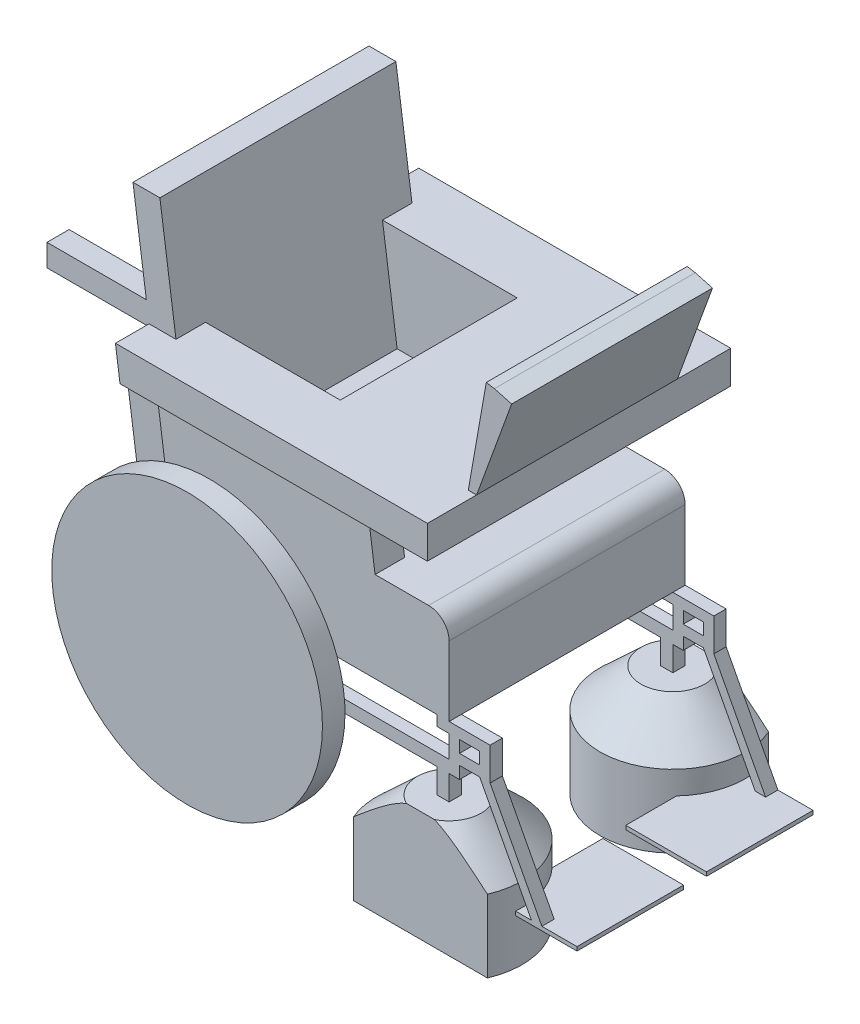
from build123d import *

# Parameters (mm, degrees)
SKETCH1_R                 = 330.2
BOSS_EXTRUDE1_DEPTH       = 55
SKETCH2_R                 = 330.2
BOSS_EXTRUDE2_DEPTH       = 55
BOSS_EXTRUDE3_DEPTH       = 10
BOSS_EXTRUDE6_DEPTH       = 575.8
BOSS_EXTRUDE33_DEPTH      = 370
BOSS_EXTRUDE33_DEPTH_BACK = 370
SKETCH25_W                = 366.7
SKETCH25_H                = 80
SKETCH5_W                 = 450
SKETCH5_H                 = 72
BOSS_EXTRUDE7_DEPTH       = 367.981167426
SKETCH8_W                 = 49.2
SKETCH8_H                 = 29.2
BOSS_EXTRUDE13_DEPTH      = 30
SKETCH19_R                = 177.8
BOSS_EXTRUDE22_DEPTH      = 270.2
CHAMFER1_SIZE             = 100
CHAMFER1_SIZE2            = 93.251508614
BOSS_EXTRUDE27_DEPTH      = 30
BOSS_EXTRUDE20_DEPTH      = 260
SKETCH23_W                = 30
SKETCH23_H                = 60
SKETCH23_W_2              = 49.2
SKETCH23_H_2              = 25.4
SKETCH23_W_3              = 25.4
BOSS_EXTRUDE28_DEPTH      = 30
SKETCH24_R                = 177.8
BOSS_EXTRUDE29_DEPTH      = 270.2
CHAMFER2_SIZE             = 100
CHAMFER2_SIZE2            = 93.251508614
BOSS_EXTRUDE30_DEPTH      = 30
BOSS_EXTRUDE31_DEPTH      = 260
SKETCH16_W                = 250
SKETCH16_H                = 53.975
BOSS_EXTRUDE18_DEPTH      = 53.975
SKETCH18_W                = 250
SKETCH18_H                = 53.975
BOSS_EXTRUDE19_DEPTH      = 53.975
BOSS_EXTRUDE32_REACH      = 1866.083
BOSS_EXTRUDE34_REACH      = 1575.824
SKETCH26_W                = 154.1
SKETCH26_H                = 80
SKETCH27_W                = 350
SKETCH27_H                = 400
BOSS_EXTRUDE35_DEPTH      = 200
BOSS_EXTRUDE36_START      = -130
BOSS_EXTRUDE36_DEPTH      = 490
FILLET3_R                 = 50
SKETCH30_W                = 2623.123535912
SKETCH30_H                = 2390.43733062
CUT_EXTRUDE1_DEPTH        = 1887.551796433
SKETCH31_W                = 2584.765961417
SKETCH31_H                = 1828.147621016
CUT_EXTRUDE2_DEPTH        = 1855.050466041


with BuildPart() as part:
    # Sketch1 → Boss-Extrude1 (new body)
    with BuildSketch(Plane.XY):
        with Locations((330.2, 330.2)):
            Circle(SKETCH1_R)
    extrude(amount=-BOSS_EXTRUDE1_DEPTH)



with BuildPart() as body_2:
    # Sketch2 → Boss-Extrude2 (new body)
    with BuildSketch(Plane.XY.offset(-685.8)):
        with Locations((330.2, 330.2)):
            Circle(SKETCH2_R)
    extrude(amount=BOSS_EXTRUDE2_DEPTH)


with BuildPart() as part_1:
    add(part.part)

    add(body_2.part)  # Boss-Extrude3 merges body 2
    # 3DSketch2 → Boss-Extrude3 (add)
    with BuildSketch(Plane(origin=(330.2, 460, -630.8), x_dir=(0.5893057409504111, 0, 0.807910108664873), z_dir=(0, -1, 0))):
        Polygon((465.194640569, 339.322245639), (0, 0), (247.508411199, -339.322245639), (712.703051768, 0), align=None)
        Polygon((-38.304873162, 52.514157063), (0, 0), (465.194640569, 339.322245639), (426.889767407, 391.836402702), align=None)
    extrude(amount=-BOSS_EXTRUDE3_DEPTH)

    # Sketch4 → Boss-Extrude6 (add)
    with BuildSketch(Plane(origin=(0, -170.8, -630.8), x_dir=(1, 0, 0), z_dir=(0, 0, 1))):
        Polygon((208.828935151, 1364.6), (330.2, 501), (265.832575532, 491.953748438), (143.190142937, 1364.6), align=None)
    extrude(amount=BOSS_EXTRUDE6_DEPTH)

    # Sketch5 → Boss-Extrude7 (add, along a direction that is not the sketch's normal)
    with BuildSketch(Plane(origin=(0, 470, 0), x_dir=(1, 0, 0), z_dir=(0, 1, 0))):
        with Locations((535.552391309, 91)):
            Rectangle(SKETCH5_W, SKETCH5_H)
        with Locations((535.552391309, 594.8)):
            Rectangle(SKETCH5_W, SKETCH5_H)
    extrude(amount=BOSS_EXTRUDE7_DEPTH, dir=(-0.13917310096006222, 0.9902680687415708, 0))

    # Sketch8 → Boss-Extrude13 (add)
    with BuildSketch(Plane(origin=(0, 0, -630.8), x_dir=(-1, 0, 0), z_dir=(0, 0, -1))):
        Polygon((-1014.4, 360.2), (-939.8, 360.2), (-939.8, 330.2), (-914.4, 330.2), (-914.4, 270.2), (-884.4, 270.2), (-884.4, 330.2), (-330.2, 330.2), (-325.983774959, 360.2), (-914.4, 360.2), (-914.4, 414.8), (-884.4, 414.8), (-884.4, 440.2), (-1014.4, 440.2), align=None)
        with Locations((-964.4, 400.2)):
            Rectangle(SKETCH8_W, SKETCH8_H, mode=Mode.SUBTRACT)
    extrude(amount=-BOSS_EXTRUDE13_DEPTH)

    # Sketch19 → Boss-Extrude22 (add)
    with BuildSketch(Plane.XZ.offset(-270.2)):
        with Locations(Location((899.4, -615.8, 0), (0, 0, 90))):
            Circle(SKETCH19_R)
    extrude(amount=BOSS_EXTRUDE22_DEPTH)

    # Chamfer1
    chamfer1_edges = [part_1.edges().sort_by_distance(p)[0] for p in [
        (899.4, 270.2, -793.6),
    ]]
    chamfer1_side = [part_1.faces().sort_by_distance(p)[0] for p in [
        (899.4, 270.2, -788.571056572),
    ]]
    chamfer(chamfer1_edges, length=CHAMFER1_SIZE, length2=CHAMFER1_SIZE2, reference=chamfer1_side[0])

    # Sketch8<7> → Boss-Extrude27 (add)
    with BuildSketch(Plane(origin=(0, 0, -630.8), x_dir=(-1, 0, 0), z_dir=(0, 0, -1))):
        Polygon((-1014.4, 360.2), (-1140.7, 120.65), (-1115.3, 120.65), (-989, 360.2), align=None)
    extrude(amount=-BOSS_EXTRUDE27_DEPTH)

    # Sketch8<4> → Boss-Extrude20 (add)
    with BuildSketch(Plane(origin=(0, 0, -630.8), x_dir=(-1, 0, 0), z_dir=(0, 0, -1))):
        Polygon((-1226.425, 111.125), (-1226.425, 120.65), (-1140.7, 120.65), (-1115.3, 120.65), (-1029.575, 120.65), (-1029.575, 111.125), align=None)
    extrude(amount=-BOSS_EXTRUDE20_DEPTH)

    # Sketch23 → Boss-Extrude28 (add)
    with BuildSketch(Plane(origin=(0, 0, -55), x_dir=(-1, 0, 0), z_dir=(0, 0, -1))):
        with BuildLine():
            Line((-330.2, 360.2), (-659.034365601, 360.2))
            ThreePointArc((-659.034365601, 360.2), (-660.058414719, 345.215533268), (-660.4, 330.2))
            Line((-660.4, 330.2), (-330.2, 330.2))
            Line((-330.2, 330.2), (-330.2, 360.2))
        make_face()
        with BuildLine():
            Line((-914.4, 360.2), (-939.8, 360.2))
            Line((-939.8, 360.2), (-939.8, 330.2))
            Line((-939.8, 330.2), (-914.4, 330.2))
            Line((-914.4, 330.2), (-884.4, 330.2))
            Line((-884.4, 330.2), (-660.4, 330.2))
            ThreePointArc((-660.4, 330.2), (-660.058414719, 345.215533268), (-659.034365601, 360.2))
            Line((-659.034365601, 360.2), (-914.4, 360.2))
        make_face()
        with Locations((-899.4, 300.2)):
            Rectangle(SKETCH23_W, SKETCH23_H)
        Polygon((-939.8, 385.6), (-939.8, 360.2), (-914.4, 360.2), (-914.4, 414.8), (-914.4, 440.2), (-939.8, 440.2), (-939.8, 414.8), align=None)
        with Locations((-964.4, 372.9)):
            Rectangle(SKETCH23_W_2, SKETCH23_H_2)
        with Locations((-964.4, 427.5)):
            Rectangle(SKETCH23_W_2, SKETCH23_H_2)
        Polygon((-1014.4, 440.2), (-1014.4, 385.6), (-989, 385.6), (-989, 414.8), (-989, 440.2), align=None)
        with Locations((-1001.7, 372.9)):
            Rectangle(SKETCH23_W_3, SKETCH23_H_2)
        Polygon((-325.983774959, 360.2), (-330.2, 360.2), (-330.2, 330.2), align=None)
        with Locations((-899.4, 427.5)):
            Rectangle(SKETCH23_W, SKETCH23_H_2)
    extrude(amount=BOSS_EXTRUDE28_DEPTH)

    # Sketch24 → Boss-Extrude29 (add)
    with BuildSketch(Plane(origin=(0, 270.2, 0), x_dir=(-1, 0, 0), z_dir=(0, -1, 0))):
        with Locations(Location((-899.4, 70, 0), (0, 0, 270))):
            Circle(SKETCH24_R)
    extrude(amount=BOSS_EXTRUDE29_DEPTH)

    # Chamfer2
    chamfer2_edges = [part_1.edges().sort_by_distance(p)[0] for p in [
        (899.4, 270.2, -247.8),
    ]]
    chamfer2_side = [part_1.faces().sort_by_distance(p)[0] for p in [
        (899.4, 270.2, -242.771056572),
    ]]
    chamfer(chamfer2_edges, length=CHAMFER2_SIZE, length2=CHAMFER2_SIZE2, reference=chamfer2_side[0])

    # Sketch23<10> → Boss-Extrude30 (add)
    with BuildSketch(Plane(origin=(0, 0, -55), x_dir=(-1, 0, 0), z_dir=(0, 0, -1))):
        Polygon((-1014.4, 360.2), (-1140.7, 120.65), (-1115.3, 120.65), (-989, 360.2), align=None)
    extrude(amount=BOSS_EXTRUDE30_DEPTH)

    # Sketch23<12> → Boss-Extrude31 (add)
    with BuildSketch(Plane(origin=(0, 0, -55), x_dir=(-1, 0, 0), z_dir=(0, 0, -1))):
        Polygon((-1226.425, 111.125), (-1226.425, 120.65), (-1140.7, 120.65), (-1115.3, 120.65), (-1029.575, 120.65), (-1029.575, 111.125), align=None)
    extrude(amount=BOSS_EXTRUDE31_DEPTH)

    # Sketch16 → Boss-Extrude18 (add)
    with BuildSketch(Plane(origin=(0, 0, -630.8), x_dir=(-1, 0, 0), z_dir=(0, 0, -1))):
        with Locations((-58.349686454, 935.0375)):
            Rectangle(SKETCH16_W, SKETCH16_H)
    extrude(amount=-BOSS_EXTRUDE18_DEPTH)

    # Sketch18 → Boss-Extrude19 (add)
    with BuildSketch(Plane(origin=(0, 0, -55), x_dir=(-1, 0, 0), z_dir=(0, 0, -1))):
        with Locations((-58.349686454, 935.0375)):
            Rectangle(SKETCH18_W, SKETCH18_H)
    extrude(amount=BOSS_EXTRUDE19_DEPTH)

    # Boss-Extrude32: up to this face of the body (flat: up to its plane)
    boss_extrude32_end = Plane(part_1.part.faces().sort_by_distance((283.205191665, 255.458003874, -55))[0])
    # Sketch8<8> → Boss-Extrude32 (add, up to the picked face)
    with BuildSketch(Plane(origin=(0, 0, -630.8), x_dir=(-1, 0, 0), z_dir=(0, 0, -1)), mode=Mode.PRIVATE) as boss_extrude32_sk1:
        Polygon((-314.740508183, 440.2), (-283.793416381, 660.4), (-914.4, 660.4), (-914.4, 440.2), align=None)
    boss_extrude32_tool1 = split(extrude(boss_extrude32_sk1.sketch, amount=-BOSS_EXTRUDE32_REACH, mode=Mode.PRIVATE), bisect_by=boss_extrude32_end, keep=Keep.BOTH, mode=Mode.PRIVATE)
    add(boss_extrude32_tool1.solids().sort_by(Axis((606.768609, 551.223181, -630.8), (0, 0, 1)))[0])



with BuildPart() as body_2_2:
    # Sketch25 → Boss-Extrude33 (new, two sides: drawn at the far end of the back side and taken through both)
    with BuildSketch(Plane.XY.offset(-342.9).offset(-BOSS_EXTRUDE33_DEPTH_BACK)):
        with Locations((760.189311143, 874.4)):
            Rectangle(SKETCH25_W, SKETCH25_H)
    extrude(amount=BOSS_EXTRUDE33_DEPTH + BOSS_EXTRUDE33_DEPTH_BACK)


with BuildPart() as part_2:
    add(part_1.part)

    add(body_2_2.part)  # Boss-Extrude34 merges body 2 2
    # Boss-Extrude34: up to this plane
    boss_extrude34_end = Plane(origin=(143.190142937, 1193.8, 837.459616456), z_dir=(0.9902680687415708, 0.13917310096006216, 0))
    # Sketch26 → Boss-Extrude34 (add, up to the surface)
    with BuildSketch(Plane.ZY.offset(-576.839311143), mode=Mode.PRIVATE) as boss_extrude34_sk1:
        with Locations((-49.95, 874.4)):
            Rectangle(SKETCH26_W, SKETCH26_H)
    boss_extrude34_tool1 = split(extrude(boss_extrude34_sk1.sketch, amount=BOSS_EXTRUDE34_REACH, mode=Mode.PRIVATE), bisect_by=boss_extrude34_end, keep=Keep.BOTH, mode=Mode.PRIVATE)
    add(boss_extrude34_tool1.solids().sort_by_distance((576.839311, 874.4, -49.95))[0])
    # Sketch26 → Boss-Extrude34 (add, up to the surface)
    with BuildSketch(Plane.ZY.offset(-576.839311143), mode=Mode.PRIVATE) as boss_extrude34_sk2:
        with Locations((-635.85, 874.4)):
            Rectangle(SKETCH26_W, SKETCH26_H)
    boss_extrude34_tool2 = split(extrude(boss_extrude34_sk2.sketch, amount=BOSS_EXTRUDE34_REACH, mode=Mode.PRIVATE), bisect_by=boss_extrude34_end, keep=Keep.BOTH, mode=Mode.PRIVATE)
    add(boss_extrude34_tool2.solids().sort_by_distance((576.839311, 874.4, -635.85))[0])

    # Sketch27 → Boss-Extrude35 (add)
    with BuildSketch(Plane(origin=(304.944608977, 42.857169884, 0), x_dir=(0, 0, 1), z_dir=(-0.9902680687415708, -0.13917310096006216, 0))):
        with Locations((-342.9, 481.031558361)):
            Rectangle(SKETCH27_W, SKETCH27_H)
    extrude(amount=BOSS_EXTRUDE35_DEPTH)

    # Sketch29 → Boss-Extrude36 (add)
    with BuildSketch(Plane(origin=(0, 0, -712.9), x_dir=(-1, 0, 0), z_dir=(0, 0, -1)).offset(BOSS_EXTRUDE36_START)):
        Polygon((-1029.044346974, 1149.323155196), (-986.95135556, 1160.601938253), (-943.539311143, 914.4), align=None)
        Polygon((-986.95135556, 1160.601938253), (-943.539311143, 914.4), (-923.230778905, 914.4), (-967.2552005, 1164.074901806), align=None)
    extrude(amount=-BOSS_EXTRUDE36_DEPTH)

    # Fillet3
    fillet3_edges = [part_2.edges().sort_by_distance(p)[0] for p in [
        (914.4, 660.4, -342.9),
    ]]
    fillet(fillet3_edges, radius=FILLET3_R)

    # Sketch30 → Cut-Extrude1 (cut, through all)
    with BuildSketch(Plane.XY):
        with Locations((451.826678709, -534.81866531)):
            Rectangle(SKETCH30_W, SKETCH30_H)
    extrude(amount=CUT_EXTRUDE1_DEPTH, mode=Mode.SUBTRACT)

    # Sketch31 → Cut-Extrude2 (cut, through all)
    with BuildSketch(Plane(origin=(0, 0, -685.8), x_dir=(-1, 0, 0), z_dir=(0, 0, -1))):
        with Locations((-741.050727566, -253.673810508)):
            Rectangle(SKETCH31_W, SKETCH31_H)
    extrude(amount=CUT_EXTRUDE2_DEPTH, mode=Mode.SUBTRACT)


solid = part_2.part
